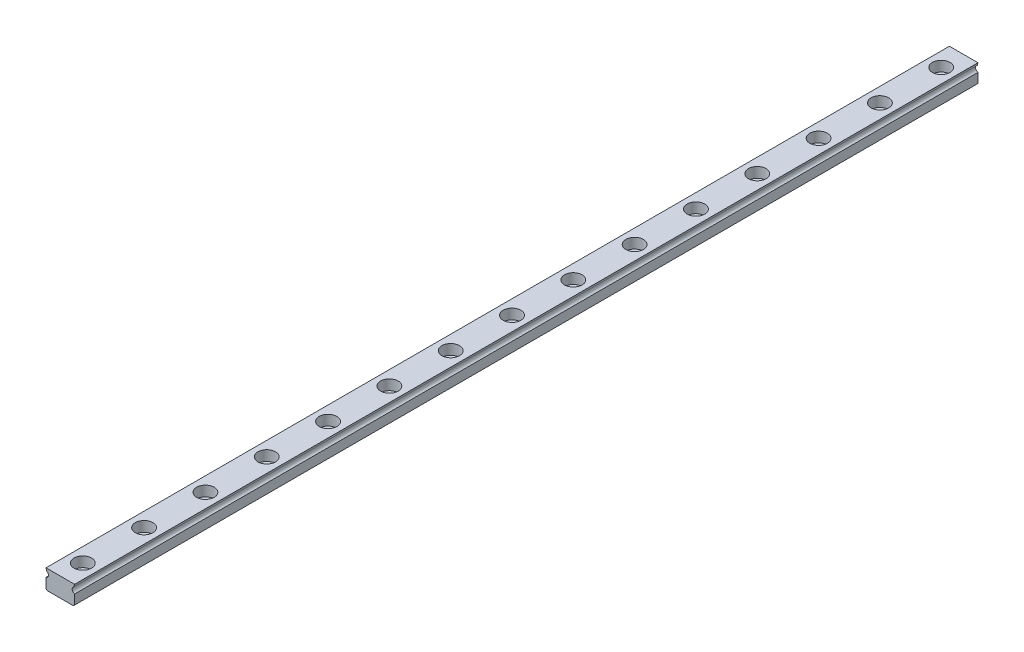
from build123d import *

# Parameters (mm, degrees)
BOSS_EXTRUDE1_DEPTH                              = 221
CBORE_FOR_M2_HEX_HEAD_MACHINE_SCREW1_D           = 2.5
CBORE_FOR_M2_HEX_HEAD_MACHINE_SCREW1_CBORE_D     = 4.3
CBORE_FOR_M2_HEX_HEAD_MACHINE_SCREW1_CBORE_DEPTH = 2.5
CHAMFER1_SIZE                                    = 0.3


with BuildPart() as part:
    # Sketch1 → Boss-Extrude1 (new body)
    with BuildSketch(Plane.XY):
        with BuildLine():
            Line((3.5, 4.7), (-3.5, 4.7))
            Line((-3.5, 4.7), (-3.333908129, 4.080136699))
            ThreePointArc((-3.333908129, 4.080136699), (-2.905114055, 3.312564712), (-3.5, 2.665153077))
            Line((-3.5, 2.665153077), (-3.5, 0))
            Line((-3.5, 0), (3.5, 0))
            Line((3.5, 0), (3.5, 2.665153077))
            ThreePointArc((3.5, 2.665153077), (2.905114055, 3.312564712), (3.333908129, 4.080136699))
            Line((3.333908129, 4.080136699), (3.5, 4.7))
        make_face()
    extrude(amount=-BOSS_EXTRUDE1_DEPTH)

    # CBORE for M2 Hex Head Machine Screw1 (through all)
    with Locations(Plane(origin=(0, 4.7, 0), x_dir=(-1, 0, 0), z_dir=(0, 1, 0))):
        with Locations((0, -5.5), (0, -20.5), (0, -35.5), (0, -50.5), (0, -65.5), (0, -80.5), (0, -95.5), (0, -110.5), (0, -125.5), (0, -140.5), (0, -155.5), (0, -170.5), (0, -185.5), (0, -200.5), (0, -215.5)):
            CounterBoreHole(CBORE_FOR_M2_HEX_HEAD_MACHINE_SCREW1_D / 2, CBORE_FOR_M2_HEX_HEAD_MACHINE_SCREW1_CBORE_D / 2, CBORE_FOR_M2_HEX_HEAD_MACHINE_SCREW1_CBORE_DEPTH)

    # Chamfer1
    chamfer1_edges = [part.edges().sort_by_distance(p)[0] for p in [
        (3.5, 0, -110.5),
        (-3.5, 0, -110.5),
    ]]
    chamfer(chamfer1_edges, length=CHAMFER1_SIZE)


solid = part.part
